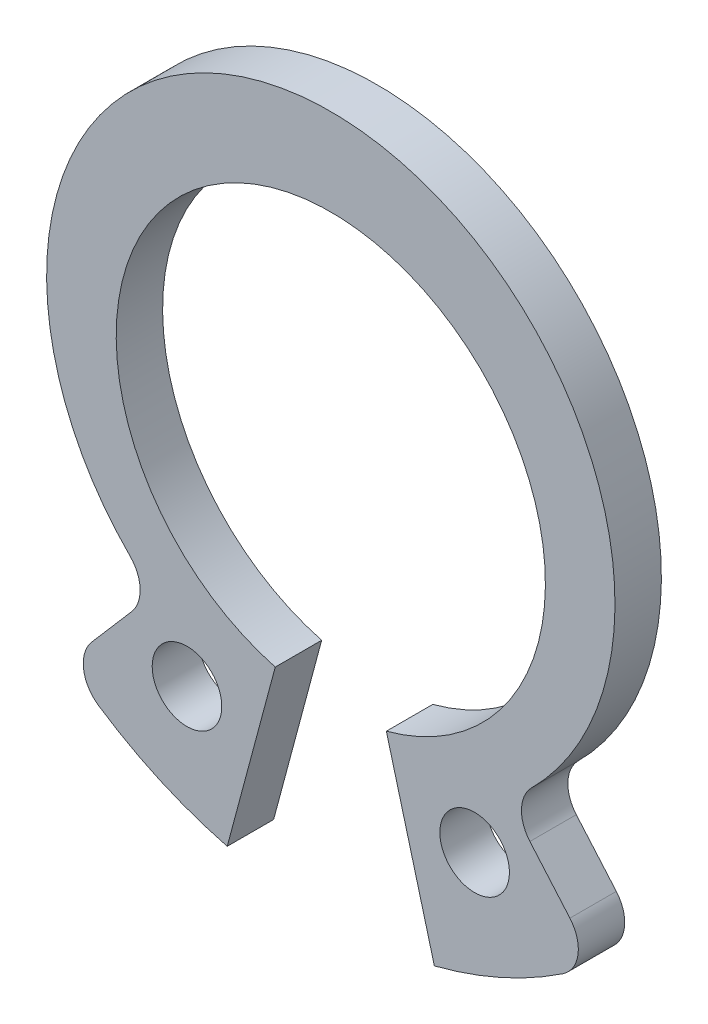
from build123d import *

# Parameters (mm, degrees)
ESQUISSE1_R          = 0.6
BASE_EXTRUSION_DEPTH = 0.8


with BuildPart() as part:
    # Esquisse1 → Base-Extrusion (new body)
    with BuildSketch(Plane.XY):
        with BuildLine():
            Line((3.432552738, -3.982826624), (4.122496002, -4.783374966))
            ThreePointArc((4.122496002, -4.783374966), (4.262571201, -5.255595313), (4.001948594, -5.673553413))
            ThreePointArc((4.001948594, -5.673553413), (2.93604213, -6.263428184), (1.785851411, -6.664888201))
            Line((1.785851411, -6.664888201), (0.957630467, -3.573925557))
            ThreePointArc((0.957630467, -3.573925557), (0, 3.7), (-0.957630467, -3.573925557))
            Line((-0.957630467, -3.573925557), (-1.785851411, -6.664888201))
            ThreePointArc((-1.785851411, -6.664888201), (-2.93604213, -6.263428184), (-4.001948594, -5.673553413))
            ThreePointArc((-4.001948594, -5.673553413), (-4.262571201, -5.255595313), (-4.122496002, -4.783374966))
            Line((-4.122496002, -4.783374966), (-3.432552738, -3.982826624))
            ThreePointArc((-3.432552738, -3.982826624), (-3.287467827, -3.568749694), (-3.463008667, -3.166636838))
            ThreePointArc((-3.463008667, -3.166636838), (0, 5.2), (3.463008667, -3.166636838))
            ThreePointArc((3.463008667, -3.166636838), (3.287467827, -3.568749694), (3.432552738, -3.982826624))
        make_face()
        with Locations((2.47978953, -4.623739485)):
            Circle(ESQUISSE1_R, mode=Mode.SUBTRACT)
        with Locations(Location((-2.47978953, -4.623739485, 0), (0, 0, 180))):
            Circle(ESQUISSE1_R, mode=Mode.SUBTRACT)
    extrude(amount=BASE_EXTRUSION_DEPTH)


solid = part.part
